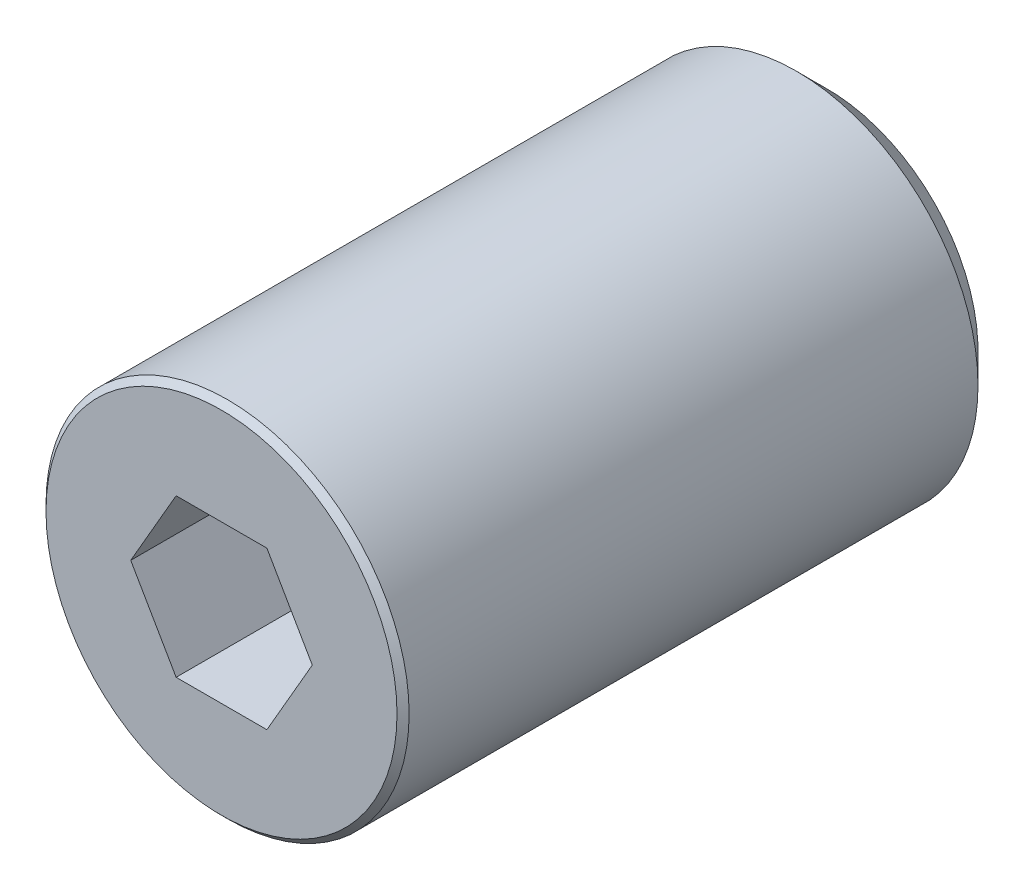
from build123d import *

# Parameters (mm, degrees)
SKETCH_1_W          = 3
SKETCH_1_H          = 10
CUT_EXTRUDE_1_DEPTH = 3
CHAMFER_1_SIZE      = 0.100000121
CHAMFER_1_SIZE2     = 0.100000075
CHAMFER_2_SIZE      = 1.125833025
CHAMFER_2_SIZE2     = 1
CHAMFER_3_SIZE      = 0.500000325
CHAMFER_3_SIZE2     = 0.500000243


with BuildPart() as part:
    # 草图1 → 旋转1 (revolve)
    with BuildSketch(Plane(origin=(0, 0, 0), x_dir=(1, 0, 0), z_dir=(0, 1, 0))):
        with Locations((1.5, -5)):
            Rectangle(SKETCH_1_W, SKETCH_1_H)
    revolve(axis=Axis((0, 0, 0), (0, 0, 1)))

    # 草图2 → 切除-拉伸1 (cut)
    with BuildSketch(Plane.XY.offset(10)):
        Polygon((0.75, -1.299038106), (1.5, 0), (0.75, 1.299038106), (-0.75, 1.299038106), (-1.5, 0), (-0.75, -1.299038106), align=None)
    extrude(amount=-CUT_EXTRUDE_1_DEPTH, mode=Mode.SUBTRACT)

    # 草图3 → 切除-旋转1 (revolve, cut)
    with BuildSketch(Plane(origin=(0, 0, 0), x_dir=(1, 0, 0), z_dir=(0, 1, 0)), mode=Mode.PRIVATE) as cut_revolve_1_sk:
        Polygon((1.499999, 0), (0, 0), (0, -0.500000312), align=None)
    revolve(cut_revolve_1_sk.sketch.rotate(Axis((0, 0, -2.5e-05), (0, 0, 1)), 180), axis=Axis((0, 0, -2.5e-05), (0, 0, 1)), mode=Mode.SUBTRACT)

    # 倒角1
    chamfer_1_edges = [part.edges().sort_by_distance(p)[0] for p in [
        (-3, 0, 10),
    ]]
    chamfer_1_side = [part.faces().sort_by_distance(p)[0] for p in [
        (-3, 0, 5),
    ]]
    chamfer(chamfer_1_edges, length=CHAMFER_1_SIZE, length2=CHAMFER_1_SIZE2, reference=chamfer_1_side[0])

    # 倒角2
    chamfer_2_edges = [part.edges().sort_by_distance(p)[0] for p in [
        (0, -1.299038106, 7),
        (-1.125, -0.649519053, 7),
        (-1.125, 0.649519053, 7),
        (0, 1.299038106, 7),
        (1.125, 0.649519053, 7),
        (1.125, -0.649519053, 7),
    ]]
    chamfer_2_side = [part.faces().sort_by_distance(p)[0] for p in [
        (0, 0, 7),
    ]]
    chamfer(chamfer_2_edges, length=CHAMFER_2_SIZE, length2=CHAMFER_2_SIZE2, reference=chamfer_2_side[0])

    # 倒角3
    chamfer_3_edges = [part.edges().sort_by_distance(p)[0] for p in [
        (-3, 0, 0),
    ]]
    chamfer_3_side = [part.faces().sort_by_distance(p)[0] for p in [
        (-3, 0, 4.94999994),
    ]]
    chamfer(chamfer_3_edges, length=CHAMFER_3_SIZE, length2=CHAMFER_3_SIZE2, reference=chamfer_3_side[0])


solid = part.part
